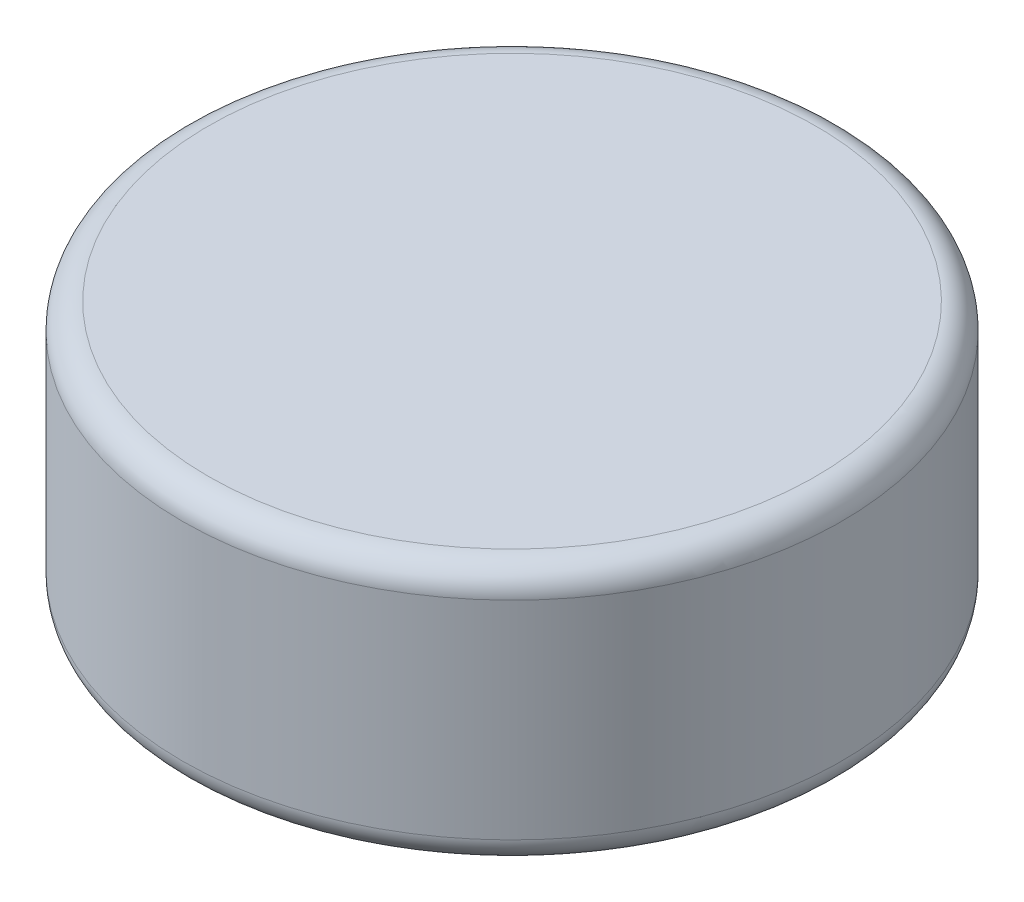
from build123d import *

# Parameters (mm, degrees)
SKETCH_1_R          = 127
EXTRUDE_1_DEPTH     = 100
FILLET_1_R          = 10
SKETCH_2_R          = 64.5
CUT_EXTRUDE_1_DEPTH = 39
FILLET_2_R          = 10


with BuildPart() as part:
    # 草图1 → 凸台-拉伸1 (new body)
    with BuildSketch(Plane(origin=(0, 0, 0), x_dir=(1, 0, 0), z_dir=(0, 1, 0))):
        with Locations(Location((0, 0, 0), (0, 0, 270))):
            Circle(SKETCH_1_R)
    extrude(amount=EXTRUDE_1_DEPTH)

    # 圆角1
    fillet_1_edges = [part.edges().sort_by_distance(p)[0] for p in [
        (0, 0, -127),
        (0, 100, -127),
    ]]
    fillet(fillet_1_edges, radius=FILLET_1_R)

    # 草图2 → 切除-拉伸1 (cut)
    with BuildSketch(Plane.XZ):
        with Locations(Location((0, 0, 0), (0, 0, 270))):
            Circle(SKETCH_2_R)
    extrude(amount=-CUT_EXTRUDE_1_DEPTH, mode=Mode.SUBTRACT)

    # 圆角2
    fillet_2_edges = [part.edges().sort_by_distance(p)[0] for p in [
        (0, 0, 64.5),
    ]]
    fillet(fillet_2_edges, radius=FILLET_2_R)


solid = part.part
